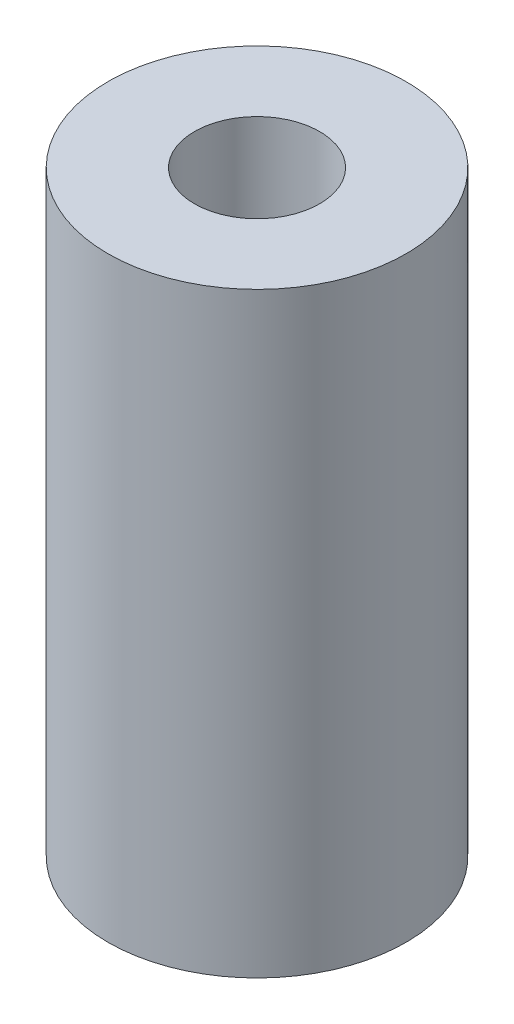
from build123d import *

# Parameters (mm, degrees)
SKETCH1_R           = 6.35
SKETCH1_R_2         = 2.667
BOSS_EXTRUDE1_DEPTH = 25.4


with BuildPart() as part:
    # Sketch1 → Boss-Extrude1 (new body)
    with BuildSketch(Plane(origin=(0, 0, 0), x_dir=(1, 0, 0), z_dir=(0, 1, 0))):
        Circle(SKETCH1_R)
        Circle(SKETCH1_R_2, mode=Mode.SUBTRACT)
    extrude(amount=BOSS_EXTRUDE1_DEPTH)


solid = part.part
